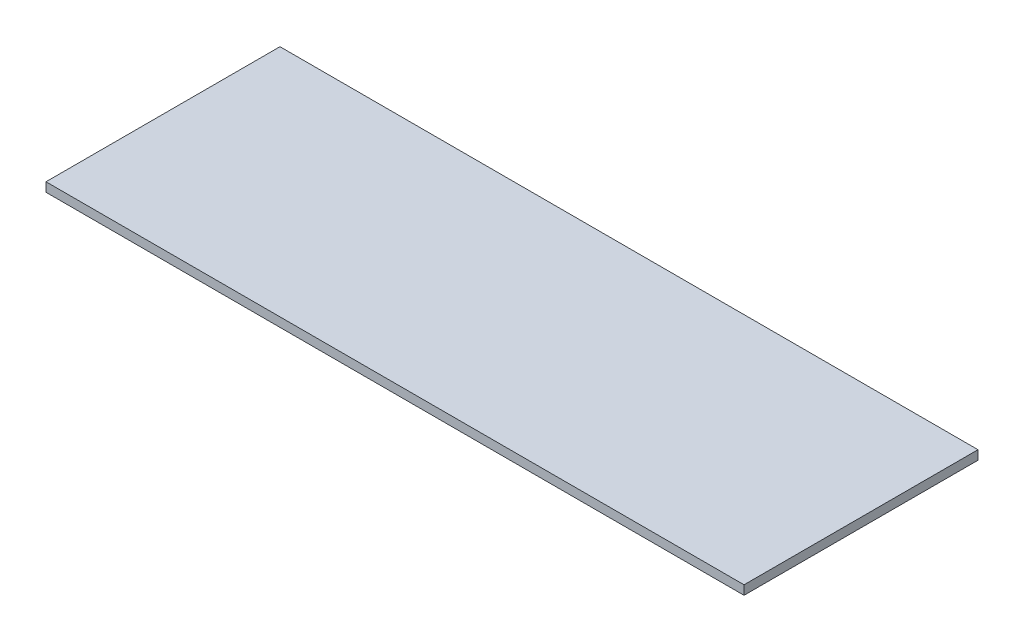
from build123d import *

# Parameters (mm, degrees)
SKETCH1_W           = 364
SKETCH1_H           = 122
BOSS_EXTRUDE2_DEPTH = 4.7625


with BuildPart() as part:
    # Sketch1 → Boss-Extrude2 (new body)
    with BuildSketch(Plane(origin=(0, 0, 0), x_dir=(1, 0, 0), z_dir=(0, 1, 0))):
        with Locations((122.871051813, 32.599481579)):
            Rectangle(SKETCH1_W, SKETCH1_H)
    extrude(amount=BOSS_EXTRUDE2_DEPTH)


solid = part.part
